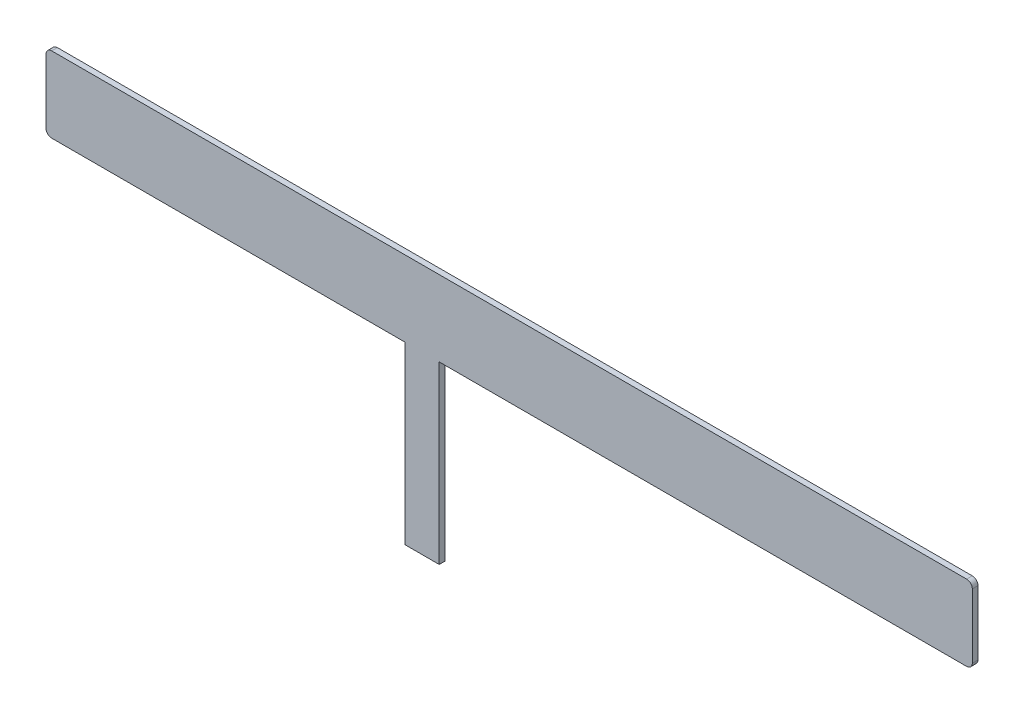
from build123d import *

# Parameters (mm, degrees)
EXTRUDE_1_DEPTH = 0.3
FILLET_1_R      = 0.3


with BuildPart() as part:
    # 草图1 → 凸台-拉伸1 (new body)
    with BuildSketch(Plane.XY):
        Polygon((-27.107233061, 9.508788635), (21.892766939, 9.508788635), (21.892766939, 5.508788635), (-6.307233061, 5.508788635), (-6.307233061, -3.771211365), (-8.107233061, -3.771211365), (-8.107233061, 5.508788635), (-27.107233061, 5.508788635), align=None)
    extrude(amount=EXTRUDE_1_DEPTH)

    # 圆角1
    fillet_1_edges = [part.edges().sort_by_distance(p)[0] for p in [
        (21.892766939, 5.508788635, 0.15),
        (21.892766939, 9.508788635, 0.15),
        (-27.107233061, 5.508788635, 0.15),
        (-27.107233061, 9.508788635, 0.15),
    ]]
    fillet(fillet_1_edges, radius=FILLET_1_R)


solid = part.part
